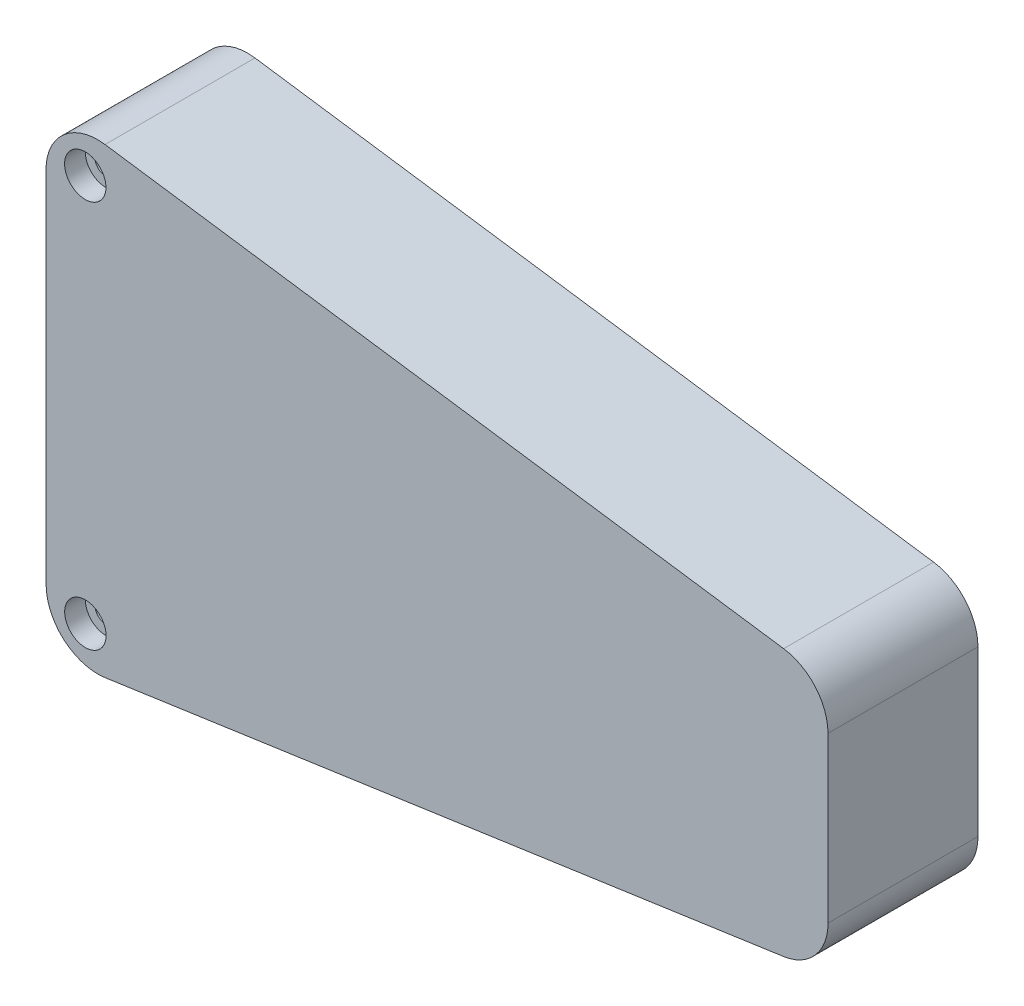
from build123d import *

# Parameters (mm, degrees)
EXTRUDE_THIN1_DEPTH            = 25
BOSS_EXTRUDE1_DEPTH            = 25
BOSS_EXTRUDE2_DEPTH            = 4
FILLET1_R                      = 10
CBORE_FOR_M4_SHCS1_D           = 4.3
CBORE_FOR_M4_SHCS1_CBORE_D     = 8
CBORE_FOR_M4_SHCS1_CBORE_DEPTH = 4
FILLET2_R                      = 5


with BuildPart() as part:
    # Sketch2 → Extrude-Thin1 (new body)
    with BuildSketch(Plane.XY):
        Polygon((239.726649941, 213.650926496), (239.696415712, 306.224679496), (390.940168333, 284.538204309), (390.956204861, 235.436188292), align=None)
        Polygon((244.724765221, 219.422538988), (244.698299899, 300.456332965), (385.941583666, 280.203800773), (385.954790061, 239.767325867), align=None, mode=Mode.SUBTRACT)
    extrude(amount=EXTRUDE_THIN1_DEPTH)

    # Sketch3 → Boss-Extrude1 (add)
    with BuildSketch(Plane.XY):
        Polygon((244.698299899, 300.456332965), (256.034798835, 298.830819854), (244.702040223, 289.003888378), align=None)
        Polygon((244.721024897, 230.874983576), (244.724765221, 219.422538988), (256.060199967, 221.055456665), align=None)
    extrude(amount=BOSS_EXTRUDE1_DEPTH)

    # Sketch4 → Boss-Extrude2 (add)
    with BuildSketch(Plane.XY.offset(25)):
        Polygon((239.696415712, 306.224679496), (390.940168333, 284.538204309), (390.956204861, 235.436188292), (239.726649941, 213.650926496), align=None)
    extrude(amount=BOSS_EXTRUDE2_DEPTH)

    # Fillet1
    fillet1_edges = [part.edges().sort_by_distance(p)[0] for p in [
        (239.726649941, 213.650926496, 14.5),
        (390.956204861, 235.436188292, 14.5),
        (390.940168333, 284.538204309, 14.5),
        (239.696415712, 306.224679496, 14.5),
    ]]
    fillet(fillet1_edges, radius=FILLET1_R)

    # CBORE for M4 SHCS1 (through all)
    with Locations(Plane(origin=(247.290055606, 297.458116912, 29), x_dir=(1, 0, 0), z_dir=(0, 0, 1))):
        with Locations((0, 0), (0.024506359, -75.035669596)):
            CounterBoreHole(CBORE_FOR_M4_SHCS1_D / 2, CBORE_FOR_M4_SHCS1_CBORE_D / 2, CBORE_FOR_M4_SHCS1_CBORE_DEPTH)

    # Fillet2
    fillet2_edges = [part.edges().sort_by_distance(p)[0] for p in [
        (385.954790061, 239.767325867, 12.5),
        (385.941583666, 280.203800773, 12.5),
        (256.034798835, 298.830819854, 12.5),
        (244.702040223, 289.003888378, 12.5),
        (244.721024897, 230.874983576, 12.5),
        (256.060199967, 221.055456665, 12.5),
    ]]
    fillet(fillet2_edges, radius=FILLET2_R)


solid = part.part
